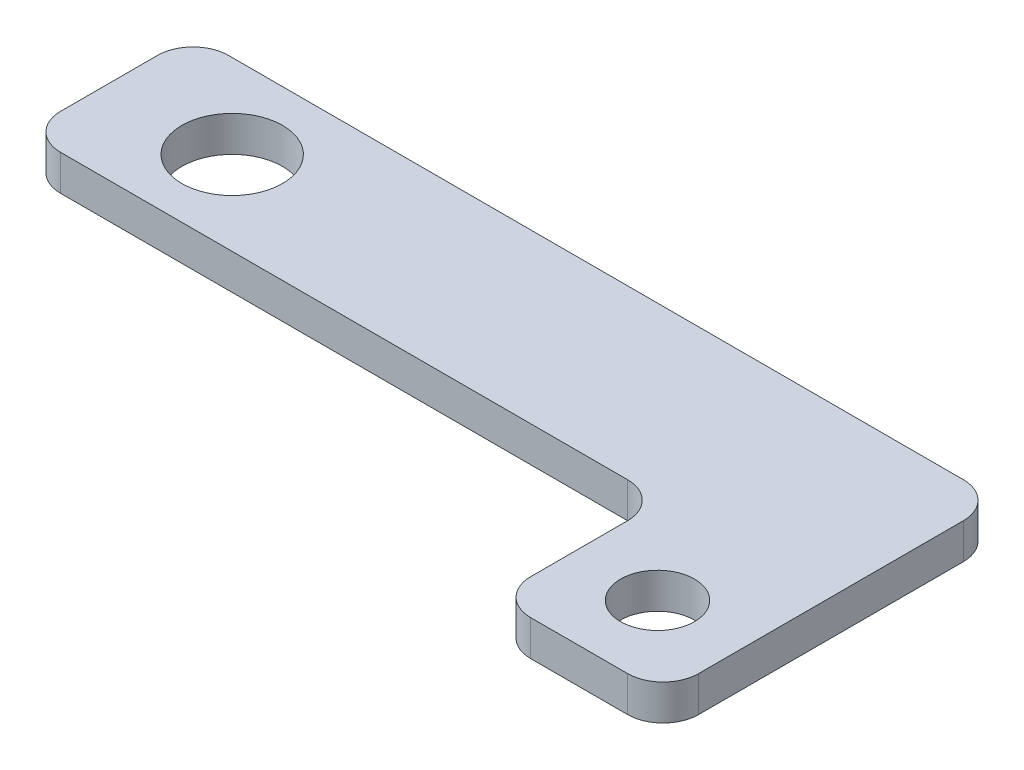
from build123d import *

# Parameters (mm, degrees)
BOSS_EXTRUDE1_DEPTH  = 3.175
M8_CLEARANCE_HOLE1_D = 9
M6_CLEARANCE_HOLE1_D = 6.6
FILLET1_R            = 3.175


with BuildPart() as part:
    # Sketch1 → Boss-Extrude1 (new body)
    with BuildSketch(Plane(origin=(0, 0, 0), x_dir=(1, 0, 0), z_dir=(0, 1, 0))):
        Polygon((10, -36.0812086), (56, -36.0812086), (56, -44.0812086), (56, -51.0812086), (71, -51.0812086), (71, -44.0812086), (71, -21.0812086), (10, -21.0812086), (-1, -21.0812086), (-1, -36.0812086), align=None)
    extrude(amount=-BOSS_EXTRUDE1_DEPTH)

    # M8 Clearance Hole1 (through all)
    with Locations(Plane(origin=(0, -3.175, 0), x_dir=(-1, 0, 0), z_dir=(0, -1, 0))):
        with Locations((-10, -28.5812086)):
            Hole(M8_CLEARANCE_HOLE1_D / 2)

    # M6 Clearance Hole1 (through all)
    with Locations(Plane(origin=(0, -3.175, 0), x_dir=(-1, 0, 0), z_dir=(0, -1, 0))):
        with Locations((-63.5, -44.0812086)):
            Hole(M6_CLEARANCE_HOLE1_D / 2)

    # Fillet1
    fillet1_edges = [part.edges().sort_by_distance(p)[0] for p in [
        (71, -1.5875, 51.0812086),
        (56, -1.5875, 51.0812086),
        (56, -1.5875, 36.0812086),
        (-1, -1.5875, 36.0812086),
        (-1, -1.5875, 21.0812086),
        (71, -1.5875, 21.0812086),
    ]]
    fillet(fillet1_edges, radius=FILLET1_R)


solid = part.part
